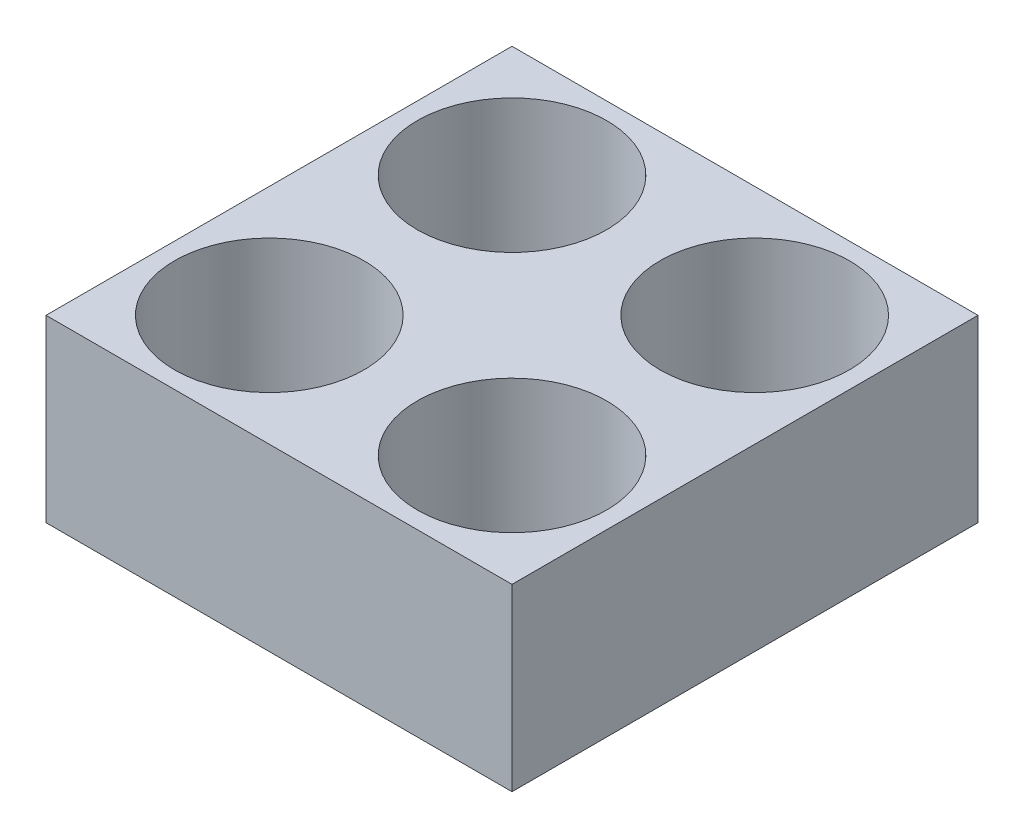
from build123d import *

# Parameters (mm, degrees)
SKETCH1_W           = 96
SKETCH1_H           = 96
SKETCH1_R           = 19.5
BOSS_EXTRUDE1_DEPTH = 35
SKETCH2_W           = 96
SKETCH2_H           = 96
BOSS_EXTRUDE2_DEPTH = 2
SKETCH3_R           = 3.6
CUT_EXTRUDE1_DEPTH  = 110.009173926


with BuildPart() as part:
    # Sketch1 → Boss-Extrude1 (new body)
    with BuildSketch(Plane(origin=(0, 0, 0), x_dir=(1, 0, 0), z_dir=(0, 1, 0))):
        with Locations((25, 25)):
            Rectangle(SKETCH1_W, SKETCH1_H)
        with Locations(Location((0, 0, 0), (0, 0, 270))):
            Circle(SKETCH1_R, mode=Mode.SUBTRACT)
        with Locations(Location((50, 0, 0), (0, 0, 270))):
            Circle(SKETCH1_R, mode=Mode.SUBTRACT)
        with Locations(Location((50, 50, 0), (0, 0, 270))):
            Circle(SKETCH1_R, mode=Mode.SUBTRACT)
        with Locations(Location((0, 50, 0), (0, 0, 270))):
            Circle(SKETCH1_R, mode=Mode.SUBTRACT)
    extrude(amount=BOSS_EXTRUDE1_DEPTH)

    # Sketch2 → Boss-Extrude2 (add)
    with BuildSketch(Plane.XZ):
        with Locations((25, -25)):
            Rectangle(SKETCH2_W, SKETCH2_H)
    extrude(amount=BOSS_EXTRUDE2_DEPTH)

    # Sketch3 → Cut-Extrude1 (cut, through all)
    with BuildSketch(Plane(origin=(0, 0, 0), x_dir=(1, 0, 0), z_dir=(0, 1, 0))):
        with Locations(Location((57, 43, 0), (0, 0, 270))):
            Circle(SKETCH3_R)
        with Locations(Location((57, 57, 0), (0, 0, 90))):
            Circle(SKETCH3_R)
        with Locations(Location((43, 43, 0), (0, 0, 90))):
            Circle(SKETCH3_R)
        with Locations(Location((43, 57, 0), (0, 0, 270))):
            Circle(SKETCH3_R)
        with Locations(Location((57, 7, 0), (0, 0, 270))):
            Circle(SKETCH3_R)
        with Locations(Location((43, 7, 0), (0, 0, 90))):
            Circle(SKETCH3_R)
        with Locations(Location((43, -7, 0), (0, 0, 270))):
            Circle(SKETCH3_R)
        with Locations(Location((57, -7, 0), (0, 0, 90))):
            Circle(SKETCH3_R)
        with Locations(Location((7, 7, 0), (0, 0, 270))):
            Circle(SKETCH3_R)
        with Locations(Location((7, -7, 0), (0, 0, 90))):
            Circle(SKETCH3_R)
        with Locations(Location((-7, -7, 0), (0, 0, 270))):
            Circle(SKETCH3_R)
        with Locations(Location((-7, 7, 0), (0, 0, 90))):
            Circle(SKETCH3_R)
        with Locations(Location((7, 57, 0), (0, 0, 270))):
            Circle(SKETCH3_R)
        with Locations(Location((7, 43, 0), (0, 0, 90))):
            Circle(SKETCH3_R)
        with Locations(Location((-7, 43, 0), (0, 0, 270))):
            Circle(SKETCH3_R)
        with Locations(Location((-7, 57, 0), (0, 0, 90))):
            Circle(SKETCH3_R)
    extrude(amount=-CUT_EXTRUDE1_DEPTH, mode=Mode.SUBTRACT)


solid = part.part
